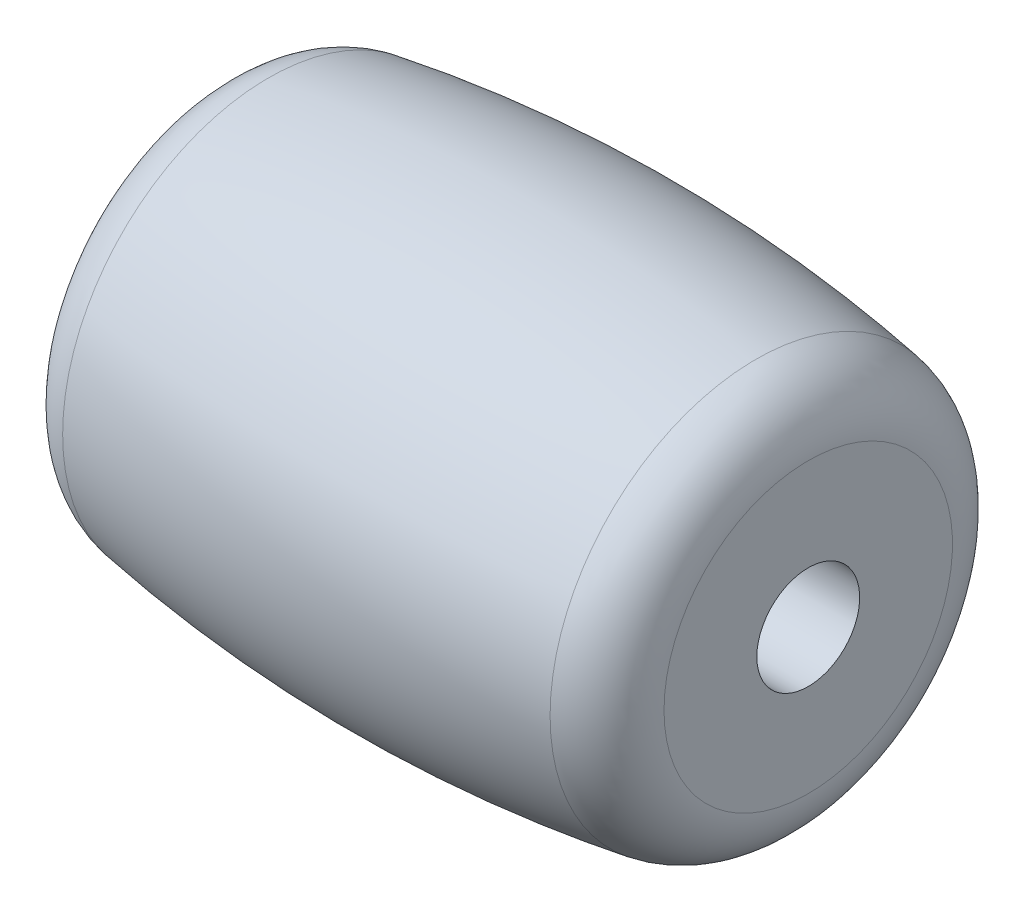
from build123d import *


with BuildPart() as part:
    # Sketch1 → Revolve1 (revolve)
    with BuildSketch(Plane(origin=(0, 0, 0), x_dir=(-1, 0, 0), z_dir=(0, 0, -1)), mode=Mode.PRIVATE) as revolve1_sk:
        with BuildLine():
            Line((-9.5, 4.627561796), (-9.5, 1.65))
            Line((-9.5, 1.65), (9.5, 1.65))
            Line((9.5, 1.65), (9.5, 4.627561796))
            ThreePointArc((9.5, 4.627561796), (9.022905314, 5.924002849), (7.819240596, 6.601918765))
            ThreePointArc((7.819240596, 6.601918765), (0, 7.23), (-7.819240596, 6.601918765))
            ThreePointArc((-7.819240596, 6.601918765), (-9.022905314, 5.924002849), (-9.5, 4.627561796))
        make_face()
    revolve(revolve1_sk.sketch.rotate(Axis((9.503089082, 0, 0), (-1, 0, 0)), 270), axis=Axis((9.503089082, 0, 0), (-1, 0, 0)))


solid = part.part
